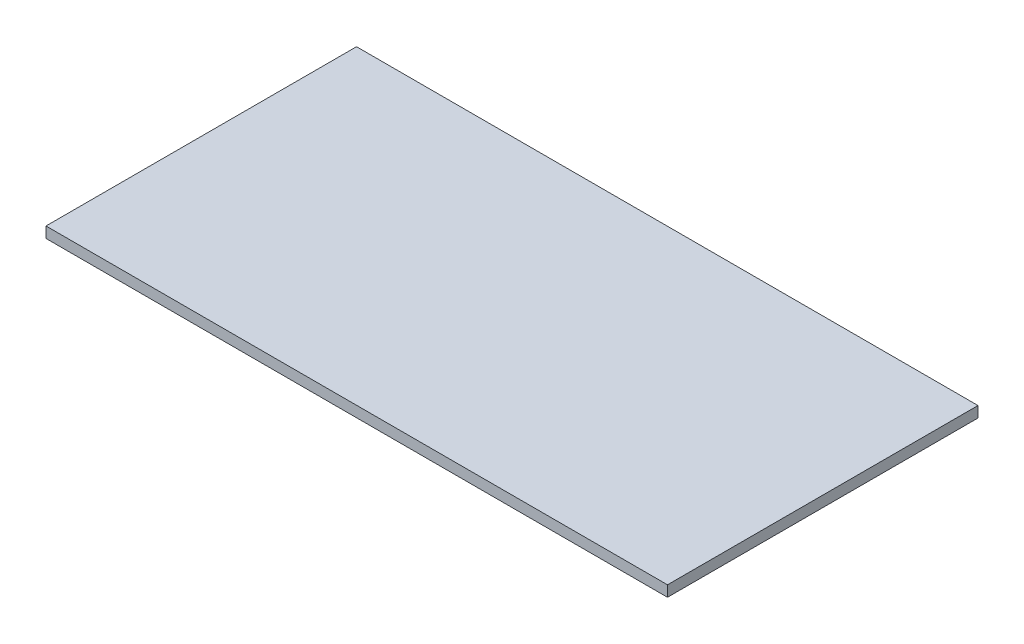
from build123d import *

# Parameters (mm, degrees)
SKETCH_1_W      = 131.9
SKETCH_1_H      = 65.9
EXTRUDE_1_DEPTH = 2.3


with BuildPart() as part:
    # 草图1 → 凸台-拉伸1 (new body)
    with BuildSketch(Plane(origin=(0, 0, 0), x_dir=(1, 0, 0), z_dir=(0, 1, 0))):
        Rectangle(SKETCH_1_W, SKETCH_1_H)
    extrude(amount=EXTRUDE_1_DEPTH)


solid = part.part
